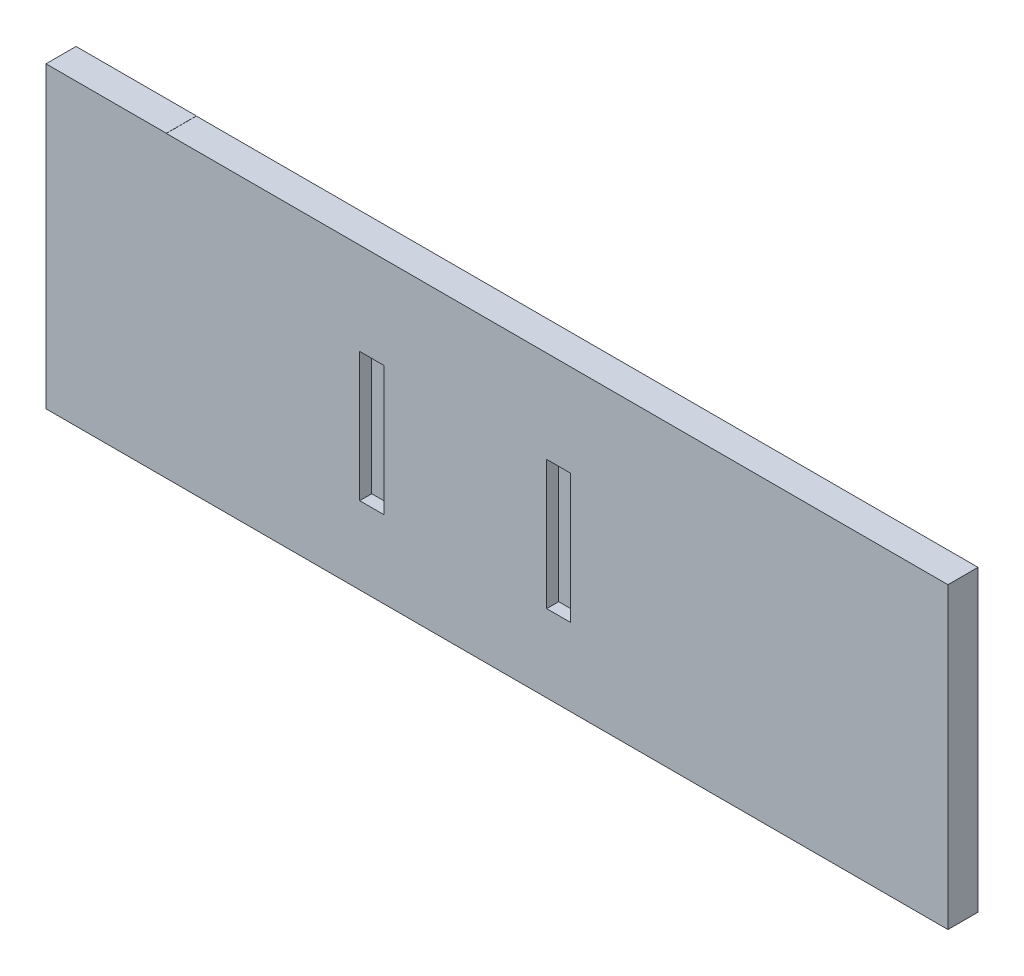
from build123d import *

# Parameters (mm, degrees)
SZKIC1_W                    = 1300
SZKIC1_H                    = 496.747706102
DODANIE_WYCI_GNI_CIE1_DEPTH = 50
WYTNIJ_WYCI_GNI_CIE1_DEPTH  = 30
SZKIC3_W                    = 200.09890069
SZKIC3_H                    = 50
DODANIE_WYCI_GNI_CIE2_DEPTH = 497


with BuildPart() as part:
    # Szkic1 → Dodanie-wyciągnięcie1 (new body)
    with BuildSketch(Plane.XY):
        with Locations((-650, 248.373853051)):
            Rectangle(SZKIC1_W, SZKIC1_H)
    extrude(amount=DODANIE_WYCI_GNI_CIE1_DEPTH)

    # Szkic2 → Wytnij-wyciągnięcie1 (cut)
    with BuildSketch(Plane.XY.offset(60)):
        Polygon((-978.316280033, 248.373853051), (-978.316280033, 343.566812888), (-938.316280033, 343.566812888), (-938.316280033, 128.566812888), (-978.316280033, 128.566812888), align=None)
        Polygon((-667.389420711, 248.373853051), (-667.389420711, 343.566812888), (-627.389420711, 343.566812888), (-627.389420711, 128.566812888), (-667.389420711, 128.566812888), align=None)
    extrude(amount=-WYTNIJ_WYCI_GNI_CIE1_DEPTH, mode=Mode.SUBTRACT)

    # Szkic3 → Dodanie-wyciągnięcie2 (add)
    with BuildSketch(Plane(origin=(0, 0, 0), x_dir=(-1, 0, 0), z_dir=(0, -1, 0))):
        with Locations((1400.049450345, -25)):
            Rectangle(SZKIC3_W, SZKIC3_H)
    extrude(amount=-DODANIE_WYCI_GNI_CIE2_DEPTH)


solid = part.part
